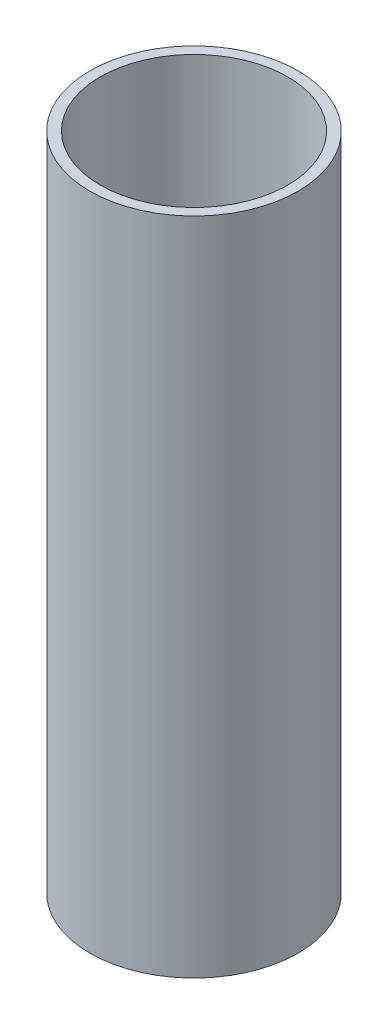
from build123d import *

# Parameters (mm, degrees)
SKETCH_1_R      = 30
SKETCH_1_R_2    = 27
EXTRUDE_1_DEPTH = 190


with BuildPart() as part:
    # 草图1 → 凸台-拉伸1 (new body)
    with BuildSketch(Plane(origin=(0, 0, 0), x_dir=(1, 0, 0), z_dir=(0, 1, 0))):
        Circle(SKETCH_1_R)
        Circle(SKETCH_1_R_2, mode=Mode.SUBTRACT)
    extrude(amount=EXTRUDE_1_DEPTH)


solid = part.part
